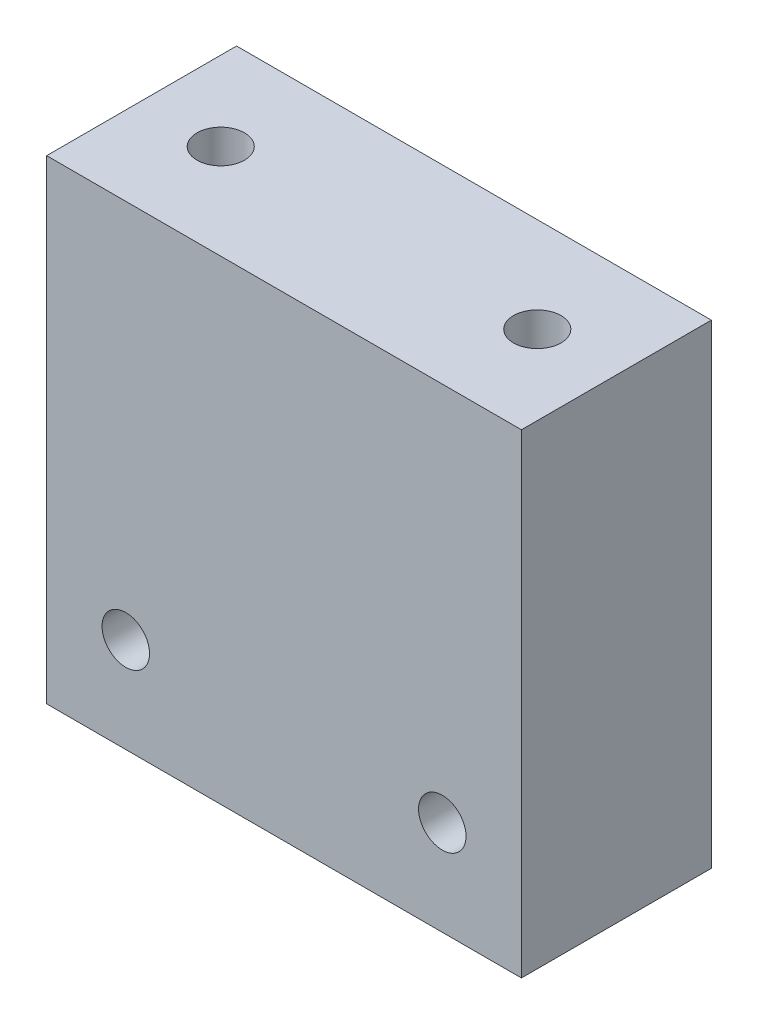
from build123d import *

# Parameters (mm, degrees)
SKETCH1_W           = 30
SKETCH1_H           = 30
BOSS_EXTRUDE1_DEPTH = 12
SKETCH2_R           = 1.5
CUT_EXTRUDE1_DEPTH  = 45.09081537
SKETCH3_R           = 1.5
CUT_EXTRUDE2_DEPTH  = 5


with BuildPart() as part:
    # Sketch1 → Boss-Extrude1 (new body)
    with BuildSketch(Plane.XY):
        with Locations((15, 15)):
            Rectangle(SKETCH1_W, SKETCH1_H)
    extrude(amount=BOSS_EXTRUDE1_DEPTH)

    # Sketch2 → Cut-Extrude1 (cut, through all)
    with BuildSketch(Plane.XY.offset(12)):
        with Locations((5, 6)):
            Circle(SKETCH2_R)
        with Locations(Location((25, 6, 0), (0, 0, 180))):
            Circle(SKETCH2_R)
    extrude(amount=-CUT_EXTRUDE1_DEPTH, mode=Mode.SUBTRACT)

    # Sketch3 → Cut-Extrude2 (cut)
    with BuildSketch(Plane(origin=(0, 30, 0), x_dir=(1, 0, 0), z_dir=(0, 1, 0))):
        with Locations(Location((5, -6, 0), (0, 0, 270))):
            Circle(SKETCH3_R)
        with Locations(Location((25, -6, 0), (0, 0, 90))):
            Circle(SKETCH3_R)
    extrude(amount=-CUT_EXTRUDE2_DEPTH, mode=Mode.SUBTRACT)


solid = part.part
